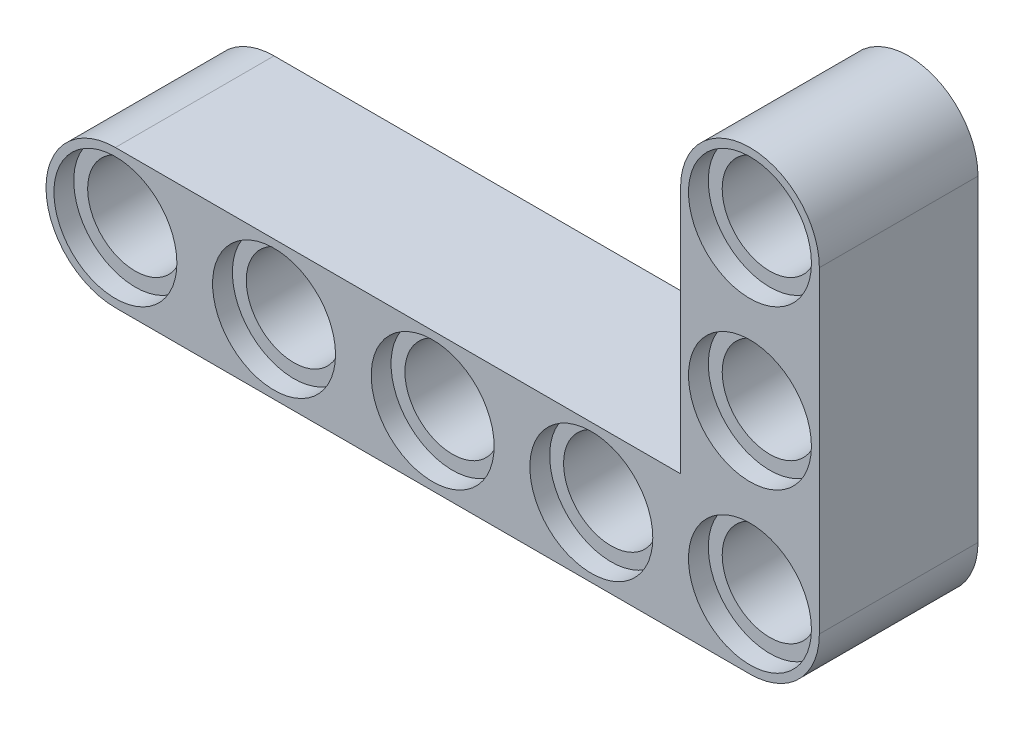
from build123d import *

# Parameters (mm, degrees)
SKETCH1_R           = 2.4
BOSS_EXTRUDE1_DEPTH = 4
SKETCH2_R           = 3.1
CUT_EXTRUDE1_DEPTH  = 1


with BuildPart() as part:
    # Sketch1 → Boss-Extrude1 (new, symmetric)
    with BuildSketch(Plane.XY):
        with BuildLine():
            Line((-16, -3.5), (16, -3.5))
            ThreePointArc((16, -3.5), (18.474873734, -2.474873734), (19.5, 0))
            Line((19.5, 0), (19.5, 16))
            ThreePointArc((19.5, 16), (16, 19.5), (12.5, 16))
            Line((12.5, 16), (12.5, 3.5))
            Line((12.5, 3.5), (-16, 3.5))
            ThreePointArc((-16, 3.5), (-19.5, 0), (-16, -3.5))
        make_face()
        Circle(SKETCH1_R, mode=Mode.SUBTRACT)
        with Locations((8, 0)):
            Circle(SKETCH1_R, mode=Mode.SUBTRACT)
        with Locations((16, 0)):
            Circle(SKETCH1_R, mode=Mode.SUBTRACT)
        with Locations((-8, 0)):
            Circle(SKETCH1_R, mode=Mode.SUBTRACT)
        with Locations((-16, 0)):
            Circle(SKETCH1_R, mode=Mode.SUBTRACT)
        with Locations((16, 8)):
            Circle(SKETCH1_R, mode=Mode.SUBTRACT)
        with Locations((16, 16)):
            Circle(SKETCH1_R, mode=Mode.SUBTRACT)
    extrude(amount=BOSS_EXTRUDE1_DEPTH, both=True)

    # Sketch2 → Cut-Extrude1 (cut)
    with BuildSketch(Plane.XY.offset(4)):
        with Locations((-16, 0)):
            Circle(SKETCH2_R)
        with Locations((-8, 0)):
            Circle(SKETCH2_R)
        Circle(SKETCH2_R)
        with Locations((8, 0)):
            Circle(SKETCH2_R)
        with Locations((16, 0)):
            Circle(SKETCH2_R)
        with Locations((16, 8)):
            Circle(SKETCH2_R)
        with Locations((16, 16)):
            Circle(SKETCH2_R)
    cut_extrude1 = extrude(amount=-CUT_EXTRUDE1_DEPTH, mode=Mode.SUBTRACT)

    # Mirror1: Cut-Extrude1 across plane
    add(cut_extrude1.mirror(Plane.XY), mode=Mode.SUBTRACT)


solid = part.part
